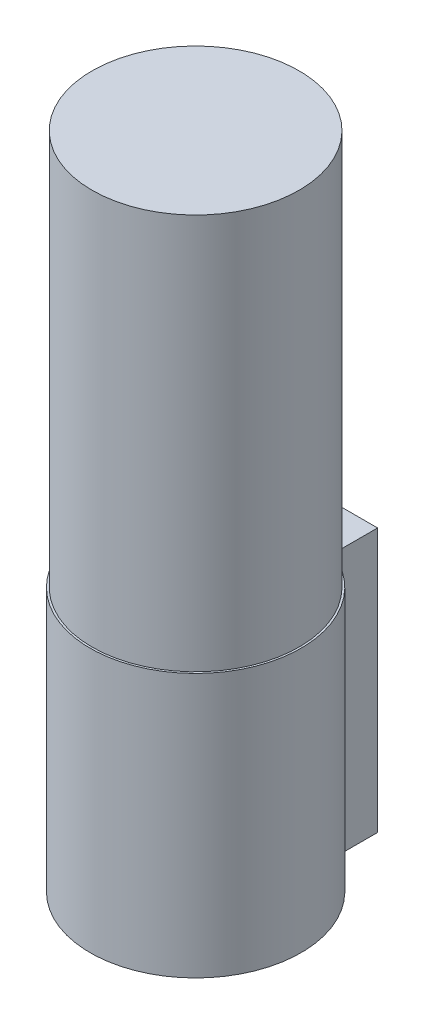
from build123d import *

# Parameters (mm, degrees)
EXTRUDE_1_DEPTH = 10
SKETCH_3_R      = 3.925
EXTRUDE_2_DEPTH = 15


with BuildPart() as part:
    # 草图1 → 凸台-拉伸1 (new body)
    with BuildSketch(Plane(origin=(0, 0, 0), x_dir=(1, 0, 0), z_dir=(0, 1, 0))):
        with BuildLine():
            ThreePointArc((1.5, 3.708099244), (0, 4), (-1.5, 3.708099244))
            Line((-1.5, 3.708099244), (-1.5, 0))
            Line((-1.5, 0), (1.5, 0))
            Line((1.5, 0), (1.5, 3.708099244))
        make_face()
        with BuildLine():
            Line((-1.5, 0), (-1.5, 3.708099244))
            ThreePointArc((-1.5, 3.708099244), (-2.236067977, -3.31662479), (4, 0))
            ThreePointArc((4, 0), (3.31662479, 2.236067977), (1.5, 3.708099244))
            Line((1.5, 3.708099244), (1.5, 0))
            Line((1.5, 0), (-1.5, 0))
        make_face()
        with BuildLine():
            ThreePointArc((1.5, 3.708099244), (0, 4), (-1.5, 3.708099244))
            Line((-1.5, 3.708099244), (-1.5, 0))
            Line((-1.5, 0), (1.5, 0))
            Line((1.5, 0), (1.5, 3.708099244))
        make_face()
        with BuildLine():
            Line((-1.5, 0), (-1.5, 3.708099244))
            ThreePointArc((-1.5, 3.708099244), (-2.236067977, -3.31662479), (4, 0))
            ThreePointArc((4, 0), (3.31662479, 2.236067977), (1.5, 3.708099244))
            Line((1.5, 3.708099244), (1.5, 0))
            Line((1.5, 0), (-1.5, 0))
        make_face()
        with BuildLine():
            Line((1.5, 5.4), (-1.5, 5.4))
            Line((-1.5, 5.4), (-1.5, 3.708099244))
            ThreePointArc((-1.5, 3.708099244), (0, 4), (1.5, 3.708099244))
            Line((1.5, 3.708099244), (1.5, 5.4))
        make_face()
    extrude(amount=EXTRUDE_1_DEPTH)

    # 草图3 → 凸台-拉伸2 (add)
    with BuildSketch(Plane(origin=(0, 10, 0), x_dir=(1, 0, 0), z_dir=(0, 1, 0))):
        with Locations(Location((0, 0, 0), (0, 0, 270))):
            Circle(SKETCH_3_R)
    extrude(amount=EXTRUDE_2_DEPTH)


solid = part.part
